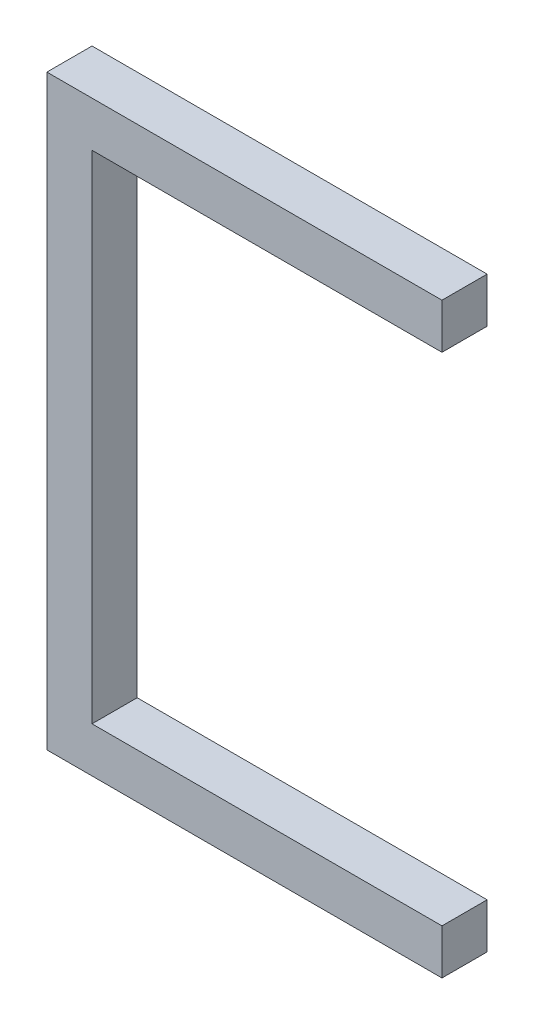
from build123d import *

# Parameters (mm, degrees)
BOSS_EXTRUDE1_DEPTH = 25.4


with BuildPart() as part:
    # Sketch2 → Boss-Extrude1 (new body)
    with BuildSketch(Plane.XY):
        Polygon((18.05156201, 338.549873221), (-204.19843799, 338.549873221), (-204.19843799, 668.749873221), (18.05156201, 668.749873221), (18.05156201, 643.349873221), (-178.79843799, 643.349873221), (-178.79843799, 363.949873221), (18.05156201, 363.949873221), align=None)
    extrude(amount=BOSS_EXTRUDE1_DEPTH)


solid = part.part
